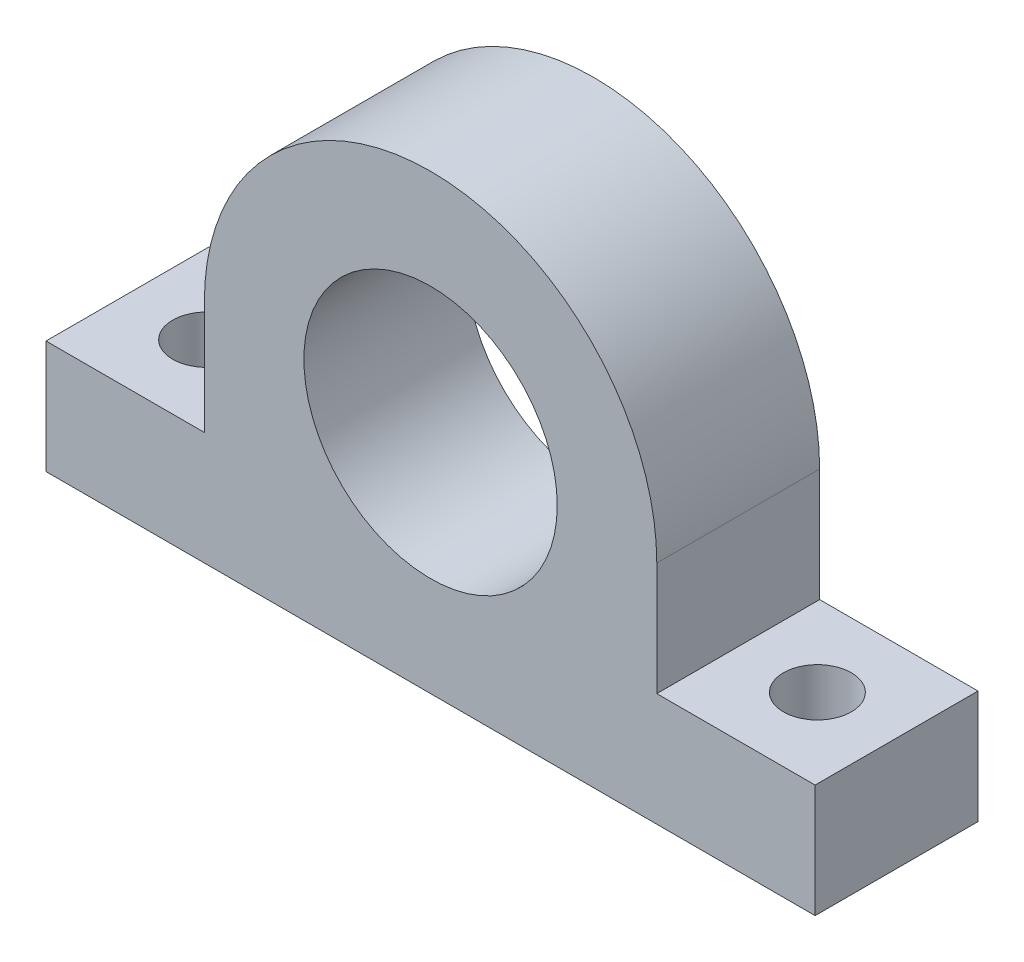
from build123d import *

# Parameters (mm, degrees)
SKETCH1_R           = 5.6
BOSS_EXTRUDE1_DEPTH = 7.2
SKETCH2_R           = 1.5
CUT_EXTRUDE1_DEPTH  = 24.787391618


with BuildPart() as part:
    # Sketch1 → Boss-Extrude1 (new body)
    with BuildSketch(Plane.XY):
        with BuildLine():
            Line((10, 0), (17, 0))
            Line((17, 0), (17, -5))
            Line((17, -5), (-17, -5))
            Line((-17, -5), (-17, 0))
            Line((-17, 0), (-10, 0))
            Line((-10, 0), (-10, 5))
            ThreePointArc((-10, 5), (0, 15), (10, 5))
            Line((10, 5), (10, 0))
        make_face()
        with Locations((0, 5)):
            Circle(SKETCH1_R, mode=Mode.SUBTRACT)
    extrude(amount=BOSS_EXTRUDE1_DEPTH)

    # Sketch2 → Cut-Extrude1 (cut, through all)
    with BuildSketch(Plane(origin=(0, 0, 0), x_dir=(1, 0, 0), z_dir=(0, 1, 0))):
        with Locations(Location((13.5, -3.6, 0), (0, 0, 180))):
            Circle(SKETCH2_R)
        with Locations((-13.5, -3.6)):
            Circle(SKETCH2_R)
    extrude(amount=-CUT_EXTRUDE1_DEPTH, mode=Mode.SUBTRACT)


solid = part.part
